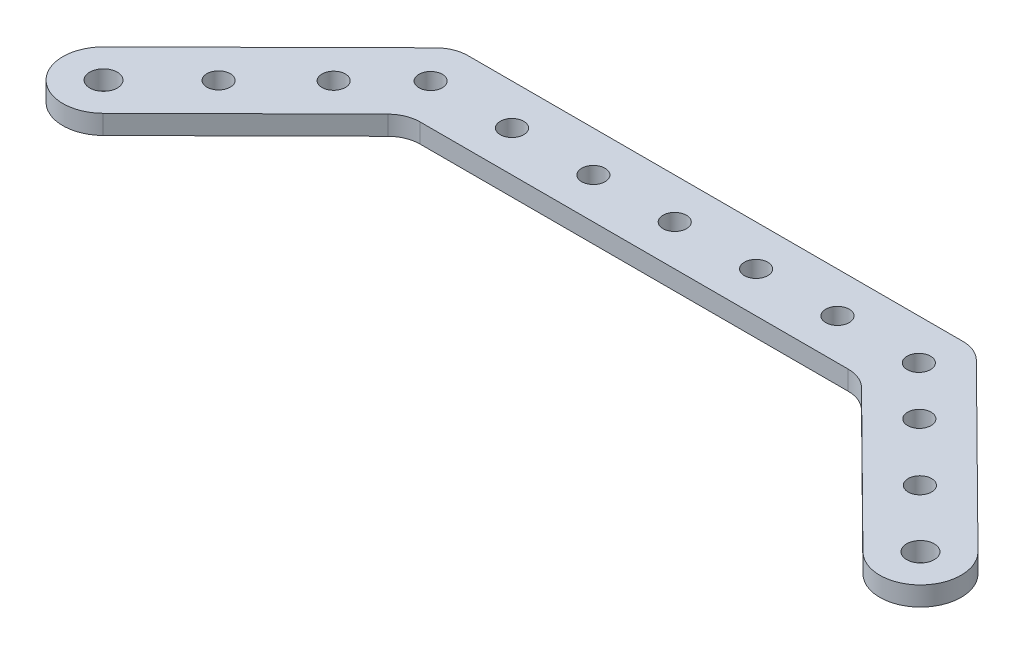
from build123d import *

# Parameters (mm, degrees)
SKETCH1_W             = 140.208
SKETCH1_H             = 38.1
BOSS_EXTRUDE1_DEPTH   = 3
SKETCH2_OUTSIDE_W     = 171.272
SKETCH2_OUTSIDE_H     = 69.164
CUT_EXTRUDE1_DEPTH    = 73.708137894
F_8_CLEARANCE_HOLE1_D = 4.3053
F_6_CLEARANCE_HOLE1_D = 3.6576
FILLET1_R             = 5.08


with BuildPart() as part:
    # Sketch1 → Boss-Extrude1 (new body)
    with BuildSketch(Plane(origin=(0, 0, 0), x_dir=(1, 0, 0), z_dir=(0, 1, 0))):
        Rectangle(SKETCH1_W, SKETCH1_H)
    extrude(amount=BOSS_EXTRUDE1_DEPTH)

    # Sketch2 outside → Cut-Extrude1 (cut, through all)
    with BuildSketch(Plane(origin=(0, 3, 0), x_dir=(1, 0, 0), z_dir=(0, 1, 0))):
        Rectangle(SKETCH2_OUTSIDE_W, SKETCH2_OUTSIDE_H)
        with BuildLine():
            Line((-59.286266177, -17.212411161), (-35.488230904, 6.35))
            Line((-35.488230904, 6.35), (35.488230904, 6.35))
            Line((35.488230904, 6.35), (59.286266177, -17.212411161))
            ThreePointArc((59.286266177, -17.212411161), (68.266411161, -17.167733823), (68.221733823, -8.187588839))
            Line((68.221733823, -8.187588839), (40.711769096, 19.05))
            Line((40.711769096, 19.05), (-40.711769096, 19.05))
            Line((-40.711769096, 19.05), (-68.221733823, -8.187588839))
            ThreePointArc((-68.221733823, -8.187588839), (-68.266411161, -17.167733823), (-59.286266177, -17.212411161))
        make_face(mode=Mode.SUBTRACT)
    extrude(amount=-CUT_EXTRUDE1_DEPTH, mode=Mode.SUBTRACT)

    # #8 Clearance Hole1 (through all)
    with Locations(Plane(origin=(0, 3, 0), x_dir=(1, 0, 0), z_dir=(0, 1, 0))):
        with Locations((-63.754, -12.7), (63.754, -12.7)):
            Hole(F_8_CLEARANCE_HOLE1_D / 2)

    # #6 Clearance Hole1 (through all)
    with Locations(Plane(origin=(0, 3, 0), x_dir=(1, 0, 0), z_dir=(0, 1, 0))):
        with Locations((-54.729177678, -3.764532354), (-45.704355355, 5.170935292), (-38.1, 12.7), (0, 12.7), (38.1, 12.7), (45.704355355, 5.170935292), (54.729177678, -3.764532354), (-25.4, 12.7), (-12.7, 12.7), (12.7, 12.7), (25.4, 12.7)):
            Hole(F_6_CLEARANCE_HOLE1_D / 2)

    # Fillet1
    fillet1_edges = [part.edges().sort_by_distance(p)[0] for p in [
        (-40.711769096, 1.5, -19.05),
        (40.711769096, 1.5, -19.05),
        (35.488230904, 1.5, -6.35),
        (-35.488230904, 1.5, -6.35),
    ]]
    fillet(fillet1_edges, radius=FILLET1_R)


solid = part.part
